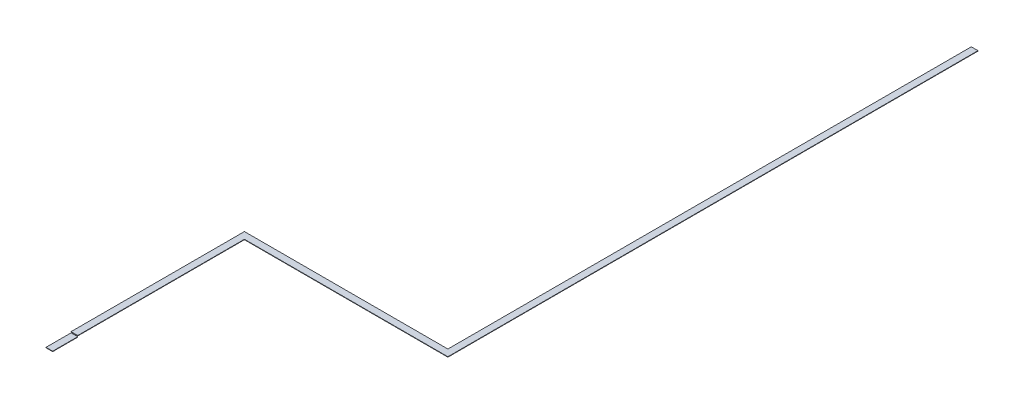
from build123d import *

# Parameters (mm, degrees)
BOSS_EXTRUDE1_DEPTH = 3.175
SKETCH2_W           = 50.8
SKETCH2_H           = 190.5
CUT_EXTRUDE1_DEPTH  = 5715.112695008
SKETCH4_W           = 50.8
SKETCH4_H           = 190.5
BOSS_EXTRUDE3_DEPTH = 3.175


with BuildPart() as part:
    # Sketch1 → Boss-Extrude1 (new body)
    with BuildSketch(Plane(origin=(0, 0, 0), x_dir=(1, 0, 0), z_dir=(0, 1, 0))):
        Polygon((0, 0), (0, 1508.125), (1546.225, 1508.125), (1546.225, 5486.4), (1597.025, 5486.4), (1597.025, 1457.325), (50.8, 1457.325), (50.8, 0), align=None)
    extrude(amount=BOSS_EXTRUDE1_DEPTH)

    # Sketch2 → Cut-Extrude1 (cut, through all)
    with BuildSketch(Plane(origin=(0, 3.175, 0), x_dir=(1, 0, 0), z_dir=(0, 1, 0))):
        with Locations((25.4, 95.25)):
            Rectangle(SKETCH2_W, SKETCH2_H)
    extrude(amount=-CUT_EXTRUDE1_DEPTH, mode=Mode.SUBTRACT)


with BuildPart() as body_2:
    # Sketch4 → Boss-Extrude3 (new body)
    with BuildSketch(Plane(origin=(0, -4.7625, 0), x_dir=(-1, 0, 0), z_dir=(0, -1, 0))):
        with Locations((-25.4, 95.25)):
            Rectangle(SKETCH4_W, SKETCH4_H)
    extrude(amount=BOSS_EXTRUDE3_DEPTH)


solid = Compound([part.part, body_2.part])
